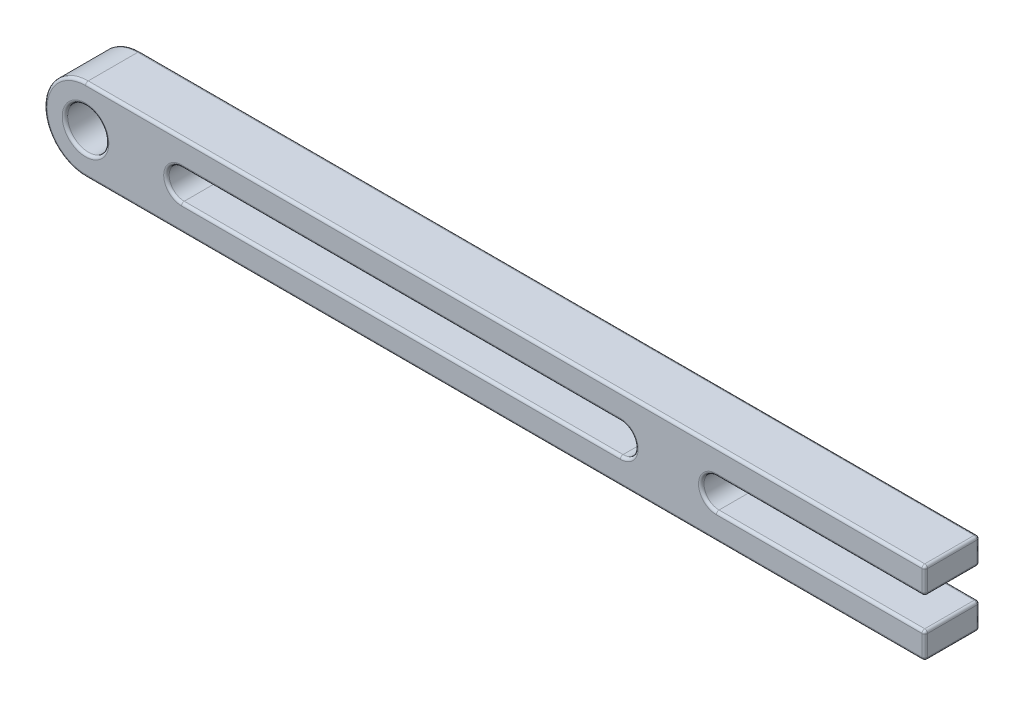
from build123d import *

# Parameters (mm, degrees)
SKETCH1_R           = 7.5
BOSS_EXTRUDE1_DEPTH = 20
FILLET1_R           = 1


with BuildPart() as part:
    # Sketch1 → Boss-Extrude1 (new body)
    with BuildSketch(Plane.XY):
        with BuildLine():
            Line((-110, 15), (196, 15))
            Line((196, 15), (196, 5.5))
            Line((196, 5.5), (120, 5.5))
            ThreePointArc((120, 5.5), (114.5, 0), (120, -5.5))
            Line((120, -5.5), (196, -5.5))
            Line((196, -5.5), (196, -15))
            Line((196, -15), (-110, -15))
            ThreePointArc((-110, -15), (-125, 0), (-110, 15))
        make_face()
        with Locations((-110, 0)):
            Circle(SKETCH1_R, mode=Mode.SUBTRACT)
        with BuildLine():
            Line((-75, 5.5), (85, 5.5))
            ThreePointArc((85, 5.5), (90.5, 0), (85, -5.5))
            Line((85, -5.5), (-75, -5.5))
            ThreePointArc((-75, -5.5), (-80.5, 0), (-75, 5.5))
        make_face(mode=Mode.SUBTRACT)
    extrude(amount=BOSS_EXTRUDE1_DEPTH)

    # Fillet1
    fillet1_edges = [part.edges().sort_by_distance(p)[0] for p in [
        (196, -10.25, 20),
        (43, -15, 0),
        (-125, 0, 0),
        (158, -5.5, 20),
        (196, 15, 10),
        (196, 5.5, 10),
        (196, -5.5, 10),
        (196, -15, 10),
        (114.5, 0, 20),
        (158, 5.5, 20),
        (196, 10.25, 20),
        (-80.5, 0, 0),
        (5, -5.5, 0),
        (90.5, 0, 0),
        (5, 5.5, 0),
        (43, 15, 20),
        (-80.5, 0, 20),
        (5, -5.5, 20),
        (90.5, 0, 20),
        (5, 5.5, 20),
        (-117.5, 0, 0),
        (-117.5, 0, 20),
        (-125, 0, 20),
        (43, -15, 20),
        (43, 15, 0),
        (196, 10.25, 0),
        (158, 5.5, 0),
        (114.5, 0, 0),
        (158, -5.5, 0),
        (196, -10.25, 0),
    ]]
    fillet(fillet1_edges, radius=FILLET1_R)


solid = part.part
